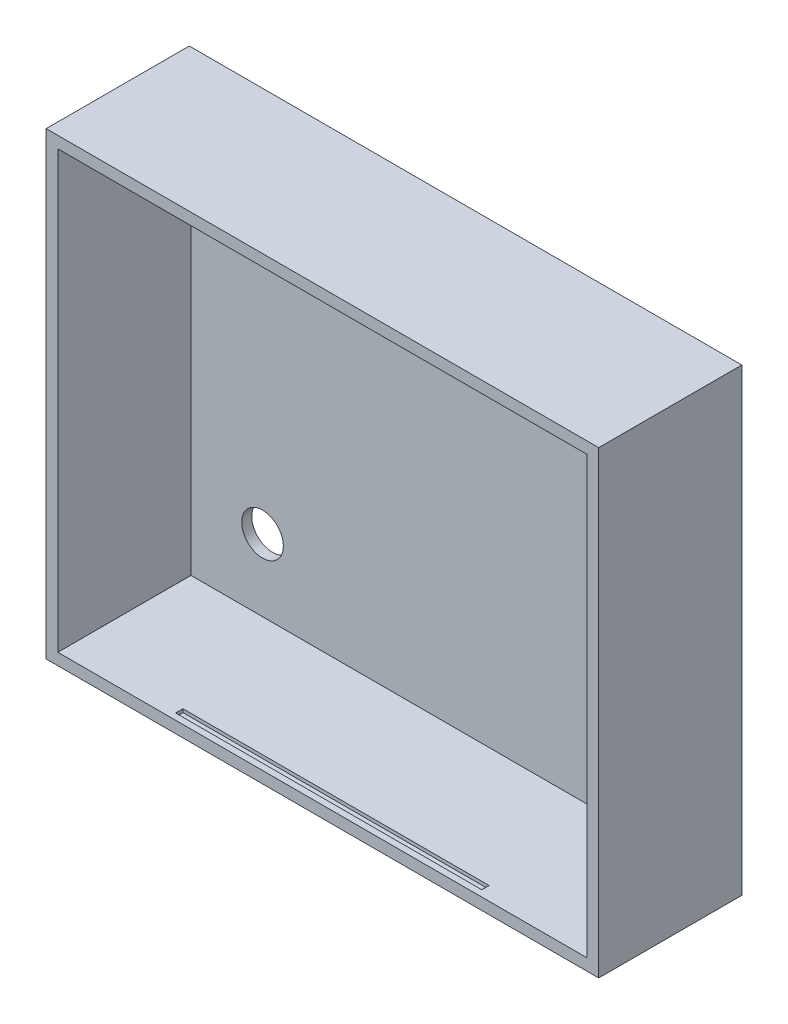
from build123d import *

# Parameters (mm, degrees)
SKETCH_1_W          = 166
SKETCH_1_H          = 138
EXTRUDE_1_DEPTH     = 3
SKETCH_2_W          = 166
SKETCH_2_H          = 138
SKETCH_2_W_2        = 159
SKETCH_2_H_2        = 131
EXTRUDE_2_DEPTH     = 40
CUT_EXTRUDE_4_REACH = 117.109
SKETCH_3_R          = 6.25
SKETCH_4_W          = 92
SKETCH_4_H          = 2.2
CUT_EXTRUDE_5_DEPTH = 1
SKETCH_5_W          = 92
SKETCH_5_H          = 2.2
CUT_EXTRUDE_6_DEPTH = 1


with BuildPart() as part:
    # 스케치1 → 보스-돌출1 (new body)
    with BuildSketch(Plane.XY):
        Rectangle(SKETCH_1_W, SKETCH_1_H)
    extrude(amount=EXTRUDE_1_DEPTH)

    # 스케치2 → 보스-돌출2 (add)
    with BuildSketch(Plane.XY.offset(3)):
        Rectangle(SKETCH_2_W, SKETCH_2_H)
        Rectangle(SKETCH_2_W_2, SKETCH_2_H_2, mode=Mode.SUBTRACT)
    extrude(amount=EXTRUDE_2_DEPTH)

    # 스케치3 → 컷-돌출4 (cut, up to next)
    with BuildSketch(Plane.XY.offset(3), mode=Mode.PRIVATE) as cut_extrude_4_sk1:
        with Locations((-58, 44)):
            Circle(SKETCH_3_R)
    cut_extrude_4_tool1 = extrude(cut_extrude_4_sk1.sketch, amount=-CUT_EXTRUDE_4_REACH, mode=Mode.PRIVATE) & part.part
    # 스케치3 → 컷-돌출4 (cut, up to next)
    with BuildSketch(Plane.XY.offset(3), mode=Mode.PRIVATE) as cut_extrude_4_sk2:
        with Locations((-58, -44)):
            Circle(SKETCH_3_R)
    cut_extrude_4_tool2 = extrude(cut_extrude_4_sk2.sketch, amount=-CUT_EXTRUDE_4_REACH, mode=Mode.PRIVATE) & part.part
    # 스케치3 → 컷-돌출4 (cut, up to next)
    with BuildSketch(Plane.XY.offset(3), mode=Mode.PRIVATE) as cut_extrude_4_sk3:
        with Locations((58, -44)):
            Circle(SKETCH_3_R)
    cut_extrude_4_tool3 = extrude(cut_extrude_4_sk3.sketch, amount=-CUT_EXTRUDE_4_REACH, mode=Mode.PRIVATE) & part.part
    # 스케치3 → 컷-돌출4 (cut, up to next)
    with BuildSketch(Plane.XY.offset(3), mode=Mode.PRIVATE) as cut_extrude_4_sk4:
        with Locations((58, 44)):
            Circle(SKETCH_3_R)
    cut_extrude_4_tool4 = extrude(cut_extrude_4_sk4.sketch, amount=-CUT_EXTRUDE_4_REACH, mode=Mode.PRIVATE) & part.part
    add(cut_extrude_4_tool1.solids().sort_by_distance((-58, 44, 3))[0], mode=Mode.SUBTRACT)
    add(cut_extrude_4_tool2.solids().sort_by_distance((-58, -44, 3))[0], mode=Mode.SUBTRACT)
    add(cut_extrude_4_tool3.solids().sort_by_distance((58, -44, 3))[0], mode=Mode.SUBTRACT)
    add(cut_extrude_4_tool4.solids().sort_by_distance((58, 44, 3))[0], mode=Mode.SUBTRACT)

    # 스케치4 → 컷-돌출5 (cut)
    with BuildSketch(Plane.XZ.offset(-65.5)):
        with Locations((0, 40)):
            Rectangle(SKETCH_4_W, SKETCH_4_H)
    extrude(amount=-CUT_EXTRUDE_5_DEPTH, mode=Mode.SUBTRACT)

    # 스케치5 → 컷-돌출6 (cut)
    with BuildSketch(Plane(origin=(0, -65.5, 0), x_dir=(1, 0, 0), z_dir=(0, 1, 0))):
        with Locations((-0.014955436, -40)):
            Rectangle(SKETCH_5_W, SKETCH_5_H)
    extrude(amount=-CUT_EXTRUDE_6_DEPTH, mode=Mode.SUBTRACT)


solid = part.part
